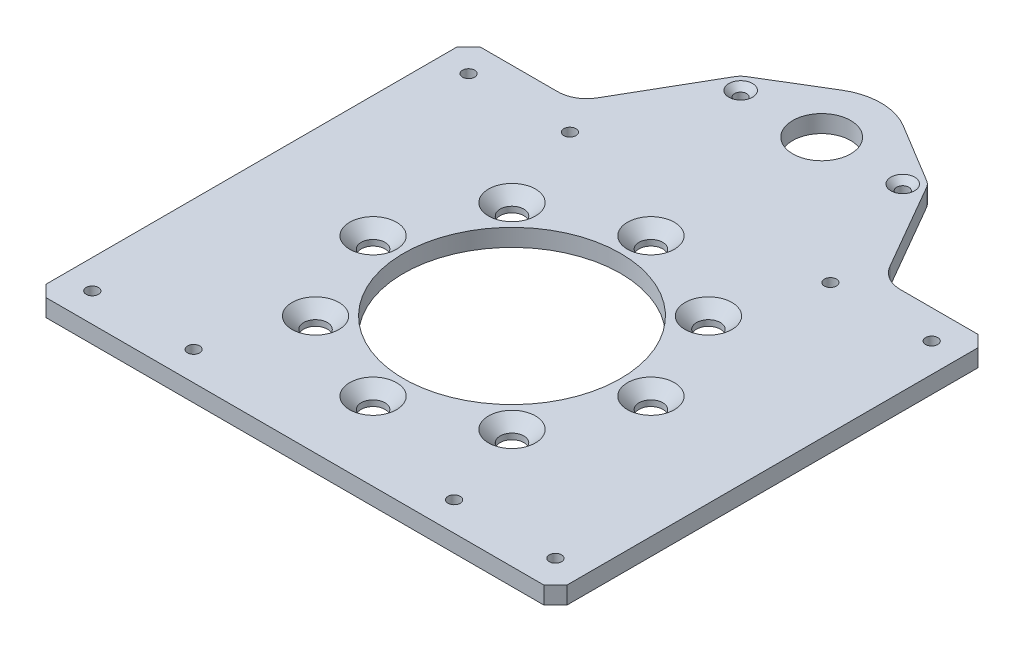
from build123d import *

# Parameters (mm, degrees)
SKETCH_1_W          = 180
SKETCH_1_H          = 150
SKETCH_1_R          = 4.1
SKETCH_1_R_2        = 2.1
EXTRUDE_1_DEPTH     = 3
CHAMFER_1_SIZE      = 4
CHAMFER_2_SIZE      = 4
CHAMFER_3_SIZE      = 2
SKETCH_3_R          = 37.5
CUT_EXTRUDE_1_DEPTH = 118.307288776
SKETCH_4_R          = 2.1
SKETCH_4_R_2        = 10
EXTRUDE_2_DEPTH     = 6
CHAMFER_4_SIZE      = 2
FILLET_1_R          = 10


with BuildPart() as part:
    # 草图1 → 凸台-拉伸1 (new, symmetric)
    with BuildSketch(Plane(origin=(0, 0, 0), x_dir=(1, 0, 0), z_dir=(0, 1, 0))):
        Rectangle(SKETCH_1_W, SKETCH_1_H)
        with Locations(Location((0, 48, 0), (0, 0, 270))):
            Circle(SKETCH_1_R, mode=Mode.SUBTRACT)
        with Locations(Location((33.941125497, 33.941125497, 0), (0, 0, 270))):
            Circle(SKETCH_1_R, mode=Mode.SUBTRACT)
        with Locations(Location((48, 0, 0), (0, 0, 270))):
            Circle(SKETCH_1_R, mode=Mode.SUBTRACT)
        with Locations(Location((33.941125497, -33.941125497, 0), (0, 0, 270))):
            Circle(SKETCH_1_R, mode=Mode.SUBTRACT)
        with Locations(Location((0, -48, 0), (0, 0, 270))):
            Circle(SKETCH_1_R, mode=Mode.SUBTRACT)
        with Locations(Location((-33.941125497, -33.941125497, 0), (0, 0, 270))):
            Circle(SKETCH_1_R, mode=Mode.SUBTRACT)
        with Locations(Location((-48, 0, 0), (0, 0, 270))):
            Circle(SKETCH_1_R, mode=Mode.SUBTRACT)
        with Locations(Location((-33.941125497, 33.941125497, 0), (0, 0, 270))):
            Circle(SKETCH_1_R, mode=Mode.SUBTRACT)
        with Locations(Location((-80, 65, 0), (0, 0, 270))):
            Circle(SKETCH_1_R_2, mode=Mode.SUBTRACT)
        with Locations(Location((-45, 65, 0), (0, 0, 270))):
            Circle(SKETCH_1_R_2, mode=Mode.SUBTRACT)
        with Locations(Location((45, 65, 0), (0, 0, 90))):
            Circle(SKETCH_1_R_2, mode=Mode.SUBTRACT)
        with Locations(Location((80, 65, 0), (0, 0, 90))):
            Circle(SKETCH_1_R_2, mode=Mode.SUBTRACT)
        with Locations(Location((80, -65, 0), (0, 0, 270))):
            Circle(SKETCH_1_R_2, mode=Mode.SUBTRACT)
        with Locations(Location((45, -65, 0), (0, 0, 270))):
            Circle(SKETCH_1_R_2, mode=Mode.SUBTRACT)
        with Locations(Location((-45, -65, 0), (0, 0, 90))):
            Circle(SKETCH_1_R_2, mode=Mode.SUBTRACT)
        with Locations(Location((-80, -65, 0), (0, 0, 90))):
            Circle(SKETCH_1_R_2, mode=Mode.SUBTRACT)
    extrude(amount=EXTRUDE_1_DEPTH, both=True)

    # 倒角1
    chamfer_1_edges = [part.edges().sort_by_distance(p)[0] for p in [
        (0, 3, -52.1),
        (33.941125497, 3, -38.041125497),
        (48, 3, -4.1),
        (33.941125497, 3, 29.841125497),
        (0, 3, 43.9),
        (-33.941125497, 3, 29.841125497),
        (-48, 3, -4.1),
        (-33.941125497, 3, -38.041125497),
    ]]
    chamfer(chamfer_1_edges, length=CHAMFER_1_SIZE)

    # 倒角2
    chamfer_2_edges = [part.edges().sort_by_distance(p)[0] for p in [
        (90, 0, 75),
        (-90, 0, 75),
        (-90, 0, -75),
        (90, 0, -75),
    ]]
    chamfer(chamfer_2_edges, length=CHAMFER_2_SIZE)

    # 倒角3
    chamfer_3_edges = [part.edges().sort_by_distance(p)[0] for p in [
        (-80, -3, -67.1),
        (-45, -3, -67.1),
        (45, -3, -62.9),
        (80, -3, -62.9),
        (80, -3, 62.9),
        (45, -3, 62.9),
        (-45, -3, 67.1),
        (-80, -3, 67.1),
    ]]
    chamfer(chamfer_3_edges, length=CHAMFER_3_SIZE)

    # 草图3 → 切除-拉伸1 (cut, through all)
    with BuildSketch(Plane.XZ.offset(3)):
        with Locations(Location((0, 0, 0), (0, 0, 270))):
            Circle(SKETCH_3_R)
    extrude(amount=-CUT_EXTRUDE_1_DEPTH, mode=Mode.SUBTRACT)

    # 草图4 → 凸台-拉伸2 (add)
    with BuildSketch(Plane.XZ.offset(3)):
        with BuildLine():
            Line((-31.107142857, -112.132802672), (-10.616071429, -124.537075795))
            ThreePointArc((-10.616071429, -124.537075795), (0, -127.5), (10.616071429, -124.537075795))
            Line((10.616071429, -124.537075795), (31.107142857, -112.132802672))
            ThreePointArc((31.107142857, -112.132802672), (32.286419244, -111.198405658), (33.196152423, -110))
            Line((33.196152423, -110), (53.403411844, -75))
            Line((53.403411844, -75), (-53.403411844, -75))
            Line((-53.403411844, -75), (-33.196152423, -110))
            ThreePointArc((-33.196152423, -110), (-32.286419244, -111.198405658), (-31.107142857, -112.132802672))
        make_face()
        with Locations(Location((-28, -107, 0), (0, 0, 270))):
            Circle(SKETCH_4_R, mode=Mode.SUBTRACT)
        with Locations(Location((28, -107, 0), (0, 0, 270))):
            Circle(SKETCH_4_R, mode=Mode.SUBTRACT)
        with Locations(Location((0, -107, 0), (0, 0, 270))):
            Circle(SKETCH_4_R_2, mode=Mode.SUBTRACT)
    extrude(amount=-EXTRUDE_2_DEPTH)

    # 倒角4
    chamfer_4_edges = [part.edges().sort_by_distance(p)[0] for p in [
        (28, 3, -104.9),
        (-28, 3, -104.9),
    ]]
    chamfer(chamfer_4_edges, length=CHAMFER_4_SIZE)

    # 圆角1
    fillet_1_edges = [part.edges().sort_by_distance(p)[0] for p in [
        (-53.403411844, 0, -75),
        (53.403411844, 0, -75),
    ]]
    fillet(fillet_1_edges, radius=FILLET_1_R)


solid = part.part
